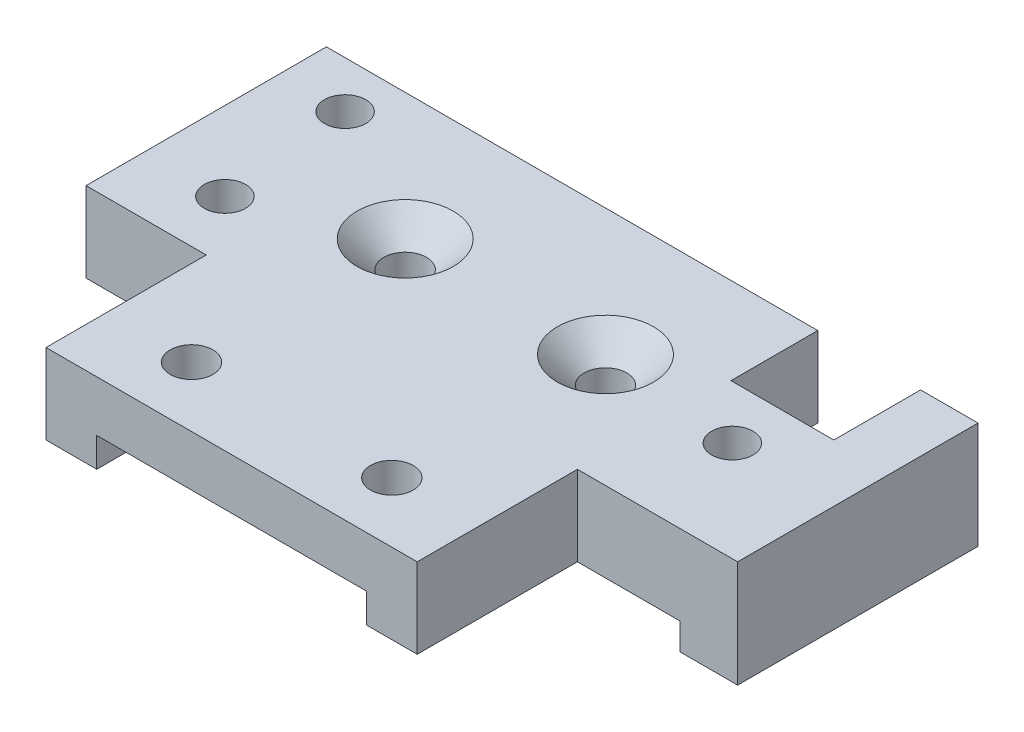
from build123d import *

# Parameters (mm, degrees)
SKETCH_1_W          = 20.2
SKETCH_1_H          = 25
SKETCH_1_R          = 1.6
EXTRUDE_1_DEPTH     = 3.8
SKETCH_2_W          = 25
SKETCH_2_H          = 6
EXTRUDE_2_DEPTH     = 3.8
SKETCH_3_W          = 25
SKETCH_3_H          = 6
EXTRUDE_3_DEPTH     = 3.8
SKETCH_4_W          = 8
SKETCH_4_H          = 6
EXTRUDE_4_DEPTH     = 12
SKETCH_5_W          = 4.3
SKETCH_5_H          = 6
EXTRUDE_5_DEPTH     = 6
SKETCH_6_W          = 4.3
SKETCH_6_H          = 14
EXTRUDE_6_DEPTH     = 2
SKETCH_7_W          = 20.2
SKETCH_7_H          = 3.8
EXTRUDE_7_DEPTH     = 5
SKETCH_8_W          = 10
SKETCH_8_H          = 6
EXTRUDE_8_DEPTH     = 9
SKETCH_9_R          = 1.55
CUT_EXTRUDE_1_DEPTH = 3
SKETCH_10_R         = 1.05
CUT_EXTRUDE_2_DEPTH = 3
SKETCH_11_W         = 9
SKETCH_11_H         = 6
EXTRUDE_9_DEPTH     = 8
SKETCH_12_R         = 1.05
CUT_EXTRUDE_3_DEPTH = 48.885279575
CHAMFER_1_SIZE      = 2
SKETCH_13_R         = 1.55
CUT_EXTRUDE_4_DEPTH = 3
SKETCH_14_W         = 4.3
SKETCH_14_H         = 2
EXTRUDE_10_DEPTH    = 5
SKETCH_15_W         = 4.3
SKETCH_15_H         = 1
SKETCH_15_W_2       = 7.7
SKETCH_15_H_2       = 1.5
CUT_EXTRUDE_5_DEPTH = 10


with BuildPart() as part:
    # 草图1 → 凸台-拉伸1 (new body)
    with BuildSketch(Plane(origin=(0, 0, 0), x_dir=(1, 0, 0), z_dir=(0, 1, 0))):
        with Locations((10.1, 12.5)):
            Rectangle(SKETCH_1_W, SKETCH_1_H)
        with Locations(Location((2.6, 4.5, 0), (0, 0, 90))):
            Circle(SKETCH_1_R, mode=Mode.SUBTRACT)
        with Locations(Location((17.6, 4.5, 0), (0, 0, 90))):
            Circle(SKETCH_1_R, mode=Mode.SUBTRACT)
        with Locations(Location((17.6, 20.5, 0), (0, 0, 90))):
            Circle(SKETCH_1_R, mode=Mode.SUBTRACT)
        with Locations(Location((2.6, 20.5, 0), (0, 0, 90))):
            Circle(SKETCH_1_R, mode=Mode.SUBTRACT)
    extrude(amount=EXTRUDE_1_DEPTH)

    # 草图2 → 凸台-拉伸2 (add)
    with BuildSketch(Plane(origin=(20.2, 0, 0), x_dir=(0, 0, -1), z_dir=(1, 0, 0))):
        with Locations((12.5, 0.8)):
            Rectangle(SKETCH_2_W, SKETCH_2_H)
    extrude(amount=EXTRUDE_2_DEPTH)

    # 草图3 → 凸台-拉伸3 (add)
    with BuildSketch(Plane.ZY):
        with Locations((-12.5, 0.8)):
            Rectangle(SKETCH_3_W, SKETCH_3_H)
    extrude(amount=EXTRUDE_3_DEPTH)

    # 草图4 → 凸台-拉伸4 (add)
    with BuildSketch(Plane(origin=(24, 0, 0), x_dir=(0, 0, -1), z_dir=(1, 0, 0))):
        with Locations((21, 0.8)):
            Rectangle(SKETCH_4_W, SKETCH_4_H)
    extrude(amount=EXTRUDE_4_DEPTH)

    # 草图5 → 凸台-拉伸5 (add)
    with BuildSketch(Plane(origin=(0, 0, -25), x_dir=(-1, 0, 0), z_dir=(0, 0, -1))):
        with Locations((-33.85, 0.8)):
            Rectangle(SKETCH_5_W, SKETCH_5_H)
    extrude(amount=EXTRUDE_5_DEPTH)

    # 草图6 → 凸台-拉伸6 (add)
    with BuildSketch(Plane(origin=(0, -2.2, 0), x_dir=(-1, 0, 0), z_dir=(0, -1, 0))):
        with Locations((-33.85, 24)):
            Rectangle(SKETCH_6_W, SKETCH_6_H)
    extrude(amount=EXTRUDE_6_DEPTH)

    # 草图7 → 凸台-拉伸7 (add)
    with BuildSketch(Plane(origin=(0, 0, -25), x_dir=(-1, 0, 0), z_dir=(0, 0, -1))):
        Polygon((-20.2, 0), (-20.2, 3.8), (-24, 3.8), (-24, -2.2), (-20.2, -2.2), align=None)
        with Locations((-10.1, 1.9)):
            Rectangle(SKETCH_7_W, SKETCH_7_H)
        Polygon((3.8, -2.2), (3.8, 3.8), (0, 3.8), (0, 0), (0, -2.2), align=None)
    extrude(amount=EXTRUDE_7_DEPTH)

    # 草图8 → 凸台-拉伸8 (add)
    with BuildSketch(Plane.ZY.offset(3.8)):
        with Locations((-25, 0.8)):
            Rectangle(SKETCH_8_W, SKETCH_8_H)
    extrude(amount=EXTRUDE_8_DEPTH)

    # 草图9 → 切除-拉伸1 (cut)
    with BuildSketch(Plane(origin=(0, 3.8, 0), x_dir=(1, 0, 0), z_dir=(0, 1, 0))):
        with Locations(Location((-7.9, 26.5, 0), (0, 0, 270))):
            Circle(SKETCH_9_R)
        with Locations(Location((28.1, 19.5, 0), (0, 0, 270))):
            Circle(SKETCH_9_R)
    extrude(amount=-CUT_EXTRUDE_1_DEPTH, mode=Mode.SUBTRACT)

    # 草图10 → 切除-拉伸2 (cut)
    with BuildSketch(Plane(origin=(0, 0.8, 0), x_dir=(1, 0, 0), z_dir=(0, 1, 0))):
        with Locations(Location((-7.9, 26.5, 0), (0, 0, 270))):
            Circle(SKETCH_10_R)
        with Locations(Location((28.1, 19.5, 0), (0, 0, 270))):
            Circle(SKETCH_10_R)
    extrude(amount=-CUT_EXTRUDE_2_DEPTH, mode=Mode.SUBTRACT)

    # 草图11 → 凸台-拉伸9 (add)
    with BuildSketch(Plane.XY.offset(-20)):
        with Locations((-8.3, 0.8)):
            Rectangle(SKETCH_11_W, SKETCH_11_H)
    extrude(amount=EXTRUDE_9_DEPTH)

    # 草图12 → 切除-拉伸3 (cut, through all)
    with BuildSketch(Plane(origin=(0, -2.2, 0), x_dir=(-1, 0, 0), z_dir=(0, -1, 0))):
        with Locations(Location((6.9, 16.5, 0), (0, 0, 90))):
            Circle(SKETCH_12_R)
    extrude(amount=-CUT_EXTRUDE_3_DEPTH, mode=Mode.SUBTRACT)

    # 倒角1
    chamfer_1_edges = [part.edges().sort_by_distance(p)[0] for p in [
        (17.6, 3.8, -18.9),
        (2.6, 3.8, -18.9),
    ]]
    chamfer(chamfer_1_edges, length=CHAMFER_1_SIZE)

    # 草图13 → 切除-拉伸4 (cut)
    with BuildSketch(Plane(origin=(0, 3.8, 0), x_dir=(1, 0, 0), z_dir=(0, 1, 0))):
        with Locations(Location((-6.9, 16.5, 0), (0, 0, 270))):
            Circle(SKETCH_13_R)
    extrude(amount=-CUT_EXTRUDE_4_DEPTH, mode=Mode.SUBTRACT)

    # 草图14 → 凸台-拉伸10 (add)
    with BuildSketch(Plane.XY.offset(-17)):
        Polygon((24, 3.8), (24, -2.2), (31.7, -2.2), (36, -2.2), (36, 3.8), align=None)
        with Locations((33.85, -3.2)):
            Rectangle(SKETCH_14_W, SKETCH_14_H)
    extrude(amount=EXTRUDE_10_DEPTH)

    # 草图15 → 切除-拉伸5 (cut)
    with BuildSketch(Plane(origin=(0, 3.8, 0), x_dir=(1, 0, 0), z_dir=(0, 1, 0))):
        with Locations((33.85, 30.5)):
            Rectangle(SKETCH_15_W, SKETCH_15_H)
        with Locations((27.85, 24.25)):
            Rectangle(SKETCH_15_W_2, SKETCH_15_H_2)
    extrude(amount=-CUT_EXTRUDE_5_DEPTH, mode=Mode.SUBTRACT)


solid = part.part
